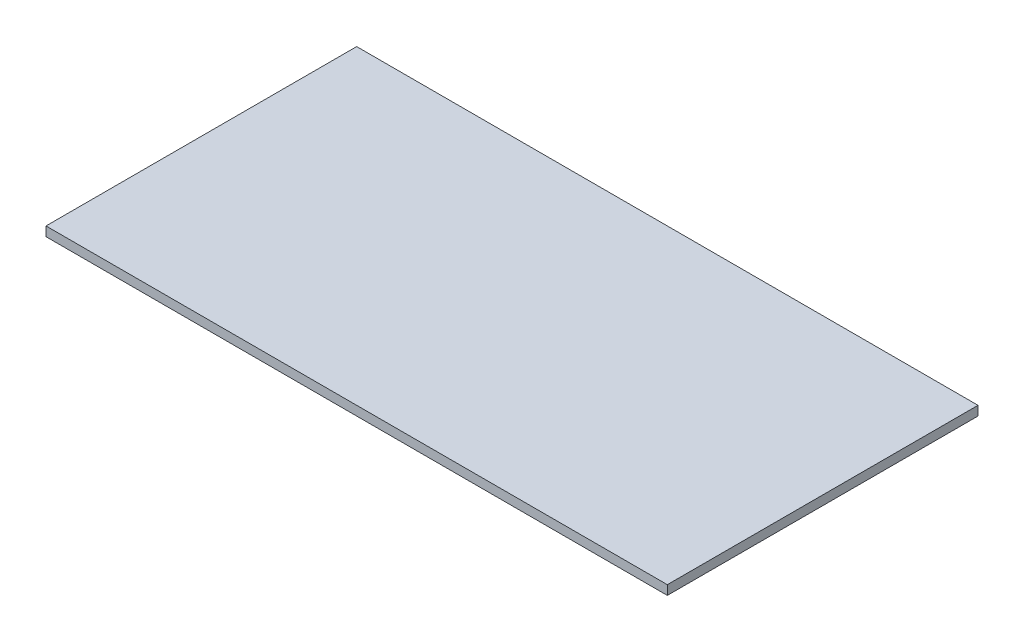
from build123d import *

# Parameters (mm, degrees)
SKETCH1_W           = 1400
SKETCH1_H           = 700
BOSS_EXTRUDE1_DEPTH = 21


with BuildPart() as part:
    # Sketch1 → Boss-Extrude1 (new body)
    with BuildSketch(Plane(origin=(0, 0, 0), x_dir=(1, 0, 0), z_dir=(0, 1, 0))):
        Rectangle(SKETCH1_W, SKETCH1_H)
    extrude(amount=BOSS_EXTRUDE1_DEPTH)


solid = part.part
